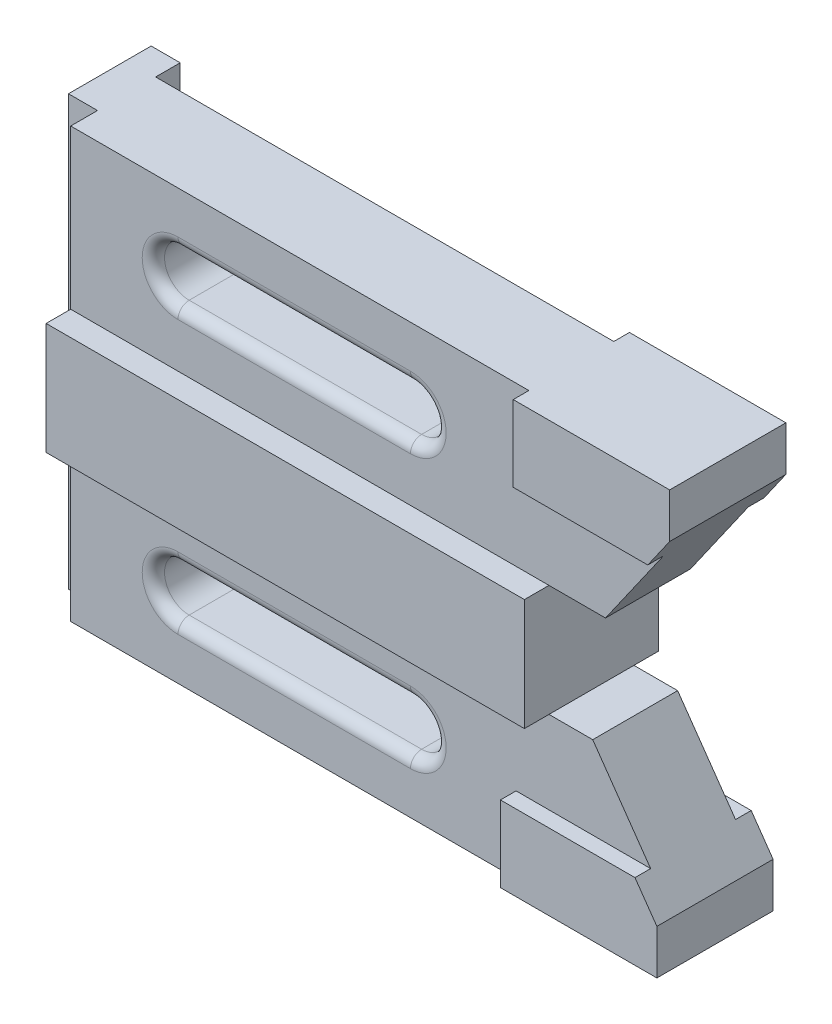
from build123d import *

# Parameters (mm, degrees)
BOSS_EXTRU_1_DEPTH      = 30
ESQUISSE3_W             = 6.5
ESQUISSE3_H             = 96
ENL_V_MAT_EXTRU_1_DEPTH = 11.5
ENL_V_START             = -5.5
ENL_V_MAT_EXTRU_2_DEPTH = 5.5
ENL_V_MAT_EXTRU_3_DEPTH = 5.5
ENL_V_MAT_EXTRU_4_DEPTH = 2
ENL_V_MAT_EXTRU_5_DEPTH = 2
CONG_2_R                = 2.5
CONG_3_R                = 2.5
CONG_4_R                = 2.5
CONG_5_R                = 2.5


with BuildPart() as part:
    # Esquisse1 → Boss.-Extru.1 (new body)
    with BuildSketch(Plane.XY):
        Polygon((-35.56359131, -94.611176471), (-35.56359131, 1.388823529), (108.43640869, 1.388823529), (108.43640869, -8.611176471), (90.581116466, -34.111176471), (77.93640869, -34.111176471), (77.93640869, -59.111176471), (87.721135464, -59.111176471), (105.576427689, -84.611176471), (105.576427689, -94.611176471), align=None)
        with BuildLine():
            Line((-5.06359131, -21.611176471), (46.93640869, -21.611176471))
            ThreePointArc((46.93640869, -21.611176471), (52.43640869, -16.111176471), (46.93640869, -10.611176471))
            Line((46.93640869, -10.611176471), (-5.06359131, -10.611176471))
            ThreePointArc((-5.06359131, -10.611176471), (-10.56359131, -16.111176471), (-5.06359131, -21.611176471))
        make_face(mode=Mode.SUBTRACT)
        with BuildLine():
            Line((-5.06359131, -82.611176471), (46.93640869, -82.611176471))
            ThreePointArc((46.93640869, -82.611176471), (52.43640869, -77.111176471), (46.93640869, -71.611176471))
            Line((46.93640869, -71.611176471), (-5.06359131, -71.611176471))
            ThreePointArc((-5.06359131, -71.611176471), (-10.56359131, -77.111176471), (-5.06359131, -82.611176471))
        make_face(mode=Mode.SUBTRACT)
    extrude(amount=BOSS_EXTRU_1_DEPTH)

    # Esquisse3 → Enlèv. mat.-Extru.1 (cut)
    with BuildSketch(Plane.XY.offset(30)):
        with Locations((-32.31359131, -46.611176471)):
            Rectangle(ESQUISSE3_W, ESQUISSE3_H)
    extrude(amount=-ENL_V_MAT_EXTRU_1_DEPTH, mode=Mode.SUBTRACT)

    # Esquisse4 → Enlèv. mat.-Extru.2 (cut)
    # profile 1 of 2: a face of its own
    with BuildSketch(Plane.XY.offset(30).offset(ENL_V_START)):
        Polygon((-29.06359131, 1.388823529), (-29.06359131, -34.111176471), (77.93640869, -34.111176471), (90.581116466, -34.111176471), (103.534955923, -15.611176471), (73.43640869, -15.611176471), (73.43640869, 1.388823529), align=None)
        with BuildLine():
            ThreePointArc((46.93640869, -10.611176471), (52.43640869, -16.111176471), (46.93640869, -21.611176471))
            Line((46.93640869, -21.611176471), (-5.06359131, -21.611176471))
            ThreePointArc((-5.06359131, -21.611176471), (-10.56359131, -16.111176471), (-5.06359131, -10.611176471))
            Line((-5.06359131, -10.611176471), (46.93640869, -10.611176471))
        make_face(mode=Mode.SUBTRACT)
    # profile 2 of 2: a face of its own
    with BuildSketch(Plane.XY.offset(30).offset(ENL_V_START)):
        Polygon((-29.06359131, -94.611176471), (70.576427689, -94.611176471), (70.576427689, -77.611176471), (100.674974921, -77.611176471), (87.721135464, -59.111176471), (77.93640869, -59.111176471), (-29.06359131, -59.111176471), align=None)
        with BuildLine():
            ThreePointArc((46.93640869, -71.611176471), (52.43640869, -77.111176471), (46.93640869, -82.611176471))
            Line((46.93640869, -82.611176471), (-5.06359131, -82.611176471))
            ThreePointArc((-5.06359131, -82.611176471), (-10.56359131, -77.111176471), (-5.06359131, -71.611176471))
            Line((-5.06359131, -71.611176471), (46.93640869, -71.611176471))
        make_face(mode=Mode.SUBTRACT)
    extrude(amount=ENL_V_MAT_EXTRU_2_DEPTH, mode=Mode.SUBTRACT)

    # Esquisse5 → Enlèv. mat.-Extru.3 (cut)
    # profile 1 of 2: a face of its own
    with BuildSketch(Plane(origin=(0, 0, 0), x_dir=(-1, 0, 0), z_dir=(0, 0, -1))):
        Polygon((-73.43640869, -15.611176471), (-103.534955923, -15.611176471), (-90.581116466, -34.111176471), (-77.93640869, -34.111176471), (29.06359131, -34.111176471), (29.06359131, 1.388823529), (-73.43640869, 1.388823529), align=None)
        with BuildLine():
            ThreePointArc((5.06359131, -10.611176471), (10.56359131, -16.111176471), (5.06359131, -21.611176471))
            Line((5.06359131, -21.611176471), (-46.93640869, -21.611176471))
            ThreePointArc((-46.93640869, -21.611176471), (-52.43640869, -16.111176471), (-46.93640869, -10.611176471))
            Line((-46.93640869, -10.611176471), (5.06359131, -10.611176471))
        make_face(mode=Mode.SUBTRACT)
    # profile 2 of 2: a face of its own
    with BuildSketch(Plane(origin=(0, 0, 0), x_dir=(-1, 0, 0), z_dir=(0, 0, -1))):
        Polygon((-77.93640869, -59.111176471), (-87.721135464, -59.111176471), (-100.674974921, -77.611176471), (-70.576427689, -77.611176471), (-70.576427689, -94.611176471), (29.06359131, -94.611176471), (29.06359131, -59.111176471), align=None)
        with BuildLine():
            ThreePointArc((5.06359131, -71.611176471), (10.56359131, -77.111176471), (5.06359131, -82.611176471))
            Line((5.06359131, -82.611176471), (-46.93640869, -82.611176471))
            ThreePointArc((-46.93640869, -82.611176471), (-52.43640869, -77.111176471), (-46.93640869, -71.611176471))
            Line((-46.93640869, -71.611176471), (5.06359131, -71.611176471))
        make_face(mode=Mode.SUBTRACT)
    extrude(amount=-ENL_V_MAT_EXTRU_3_DEPTH, mode=Mode.SUBTRACT)

    # Esquisse6 → Enlèv. mat.-Extru.4 (cut)
    with BuildSketch(Plane(origin=(0, 0, 0), x_dir=(-1, 0, 0), z_dir=(0, 0, -1))):
        Polygon((-103.534955923, -15.611176471), (-73.43640869, -15.611176471), (-73.43640869, 1.388823529), (-108.43640869, 1.388823529), (-108.43640869, -8.611176471), align=None)
        Polygon((-70.576427689, -77.611176471), (-100.674974921, -77.611176471), (-105.576427689, -84.611176471), (-105.576427689, -94.611176471), (-70.576427689, -94.611176471), align=None)
    extrude(amount=-ENL_V_MAT_EXTRU_4_DEPTH, mode=Mode.SUBTRACT)

    # Esquisse7 → Enlèv. mat.-Extru.5 (cut)
    with BuildSketch(Plane.XY.offset(30)):
        Polygon((73.43640869, -15.611176471), (103.534955923, -15.611176471), (108.43640869, -8.611176471), (108.43640869, 1.388823529), (73.43640869, 1.388823529), align=None)
        Polygon((100.674974921, -77.611176471), (70.576427689, -77.611176471), (70.576427689, -94.611176471), (105.576427689, -94.611176471), (105.576427689, -84.611176471), align=None)
    extrude(amount=-ENL_V_MAT_EXTRU_5_DEPTH, mode=Mode.SUBTRACT)

    # Congé2
    cong_2_edges = [part.edges().sort_by_distance(p)[0] for p in [
        (20.93640869, -10.611176471, 24.5),
        (-10.56359131, -16.111176471, 24.5),
        (20.93640869, -21.611176471, 24.5),
        (52.43640869, -16.111176471, 24.5),
    ]]
    fillet(cong_2_edges, radius=CONG_2_R)

    # Congé3
    cong_3_edges = [part.edges().sort_by_distance(p)[0] for p in [
        (52.43640869, -77.111176471, 24.5),
        (20.93640869, -71.611176471, 24.5),
        (-10.56359131, -77.111176471, 24.5),
        (20.93640869, -82.611176471, 24.5),
    ]]
    fillet(cong_3_edges, radius=CONG_3_R)

    # Congé4
    cong_4_edges = [part.edges().sort_by_distance(p)[0] for p in [
        (-10.56359131, -16.111176471, 5.5),
        (20.93640869, -10.611176471, 5.5),
        (52.43640869, -16.111176471, 5.5),
        (20.93640869, -21.611176471, 5.5),
    ]]
    fillet(cong_4_edges, radius=CONG_4_R)

    # Congé5
    cong_5_edges = [part.edges().sort_by_distance(p)[0] for p in [
        (-10.56359131, -77.111176471, 5.5),
        (20.93640869, -71.611176471, 5.5),
        (52.43640869, -77.111176471, 5.5),
        (20.93640869, -82.611176471, 5.5),
    ]]
    fillet(cong_5_edges, radius=CONG_5_R)


solid = part.part
